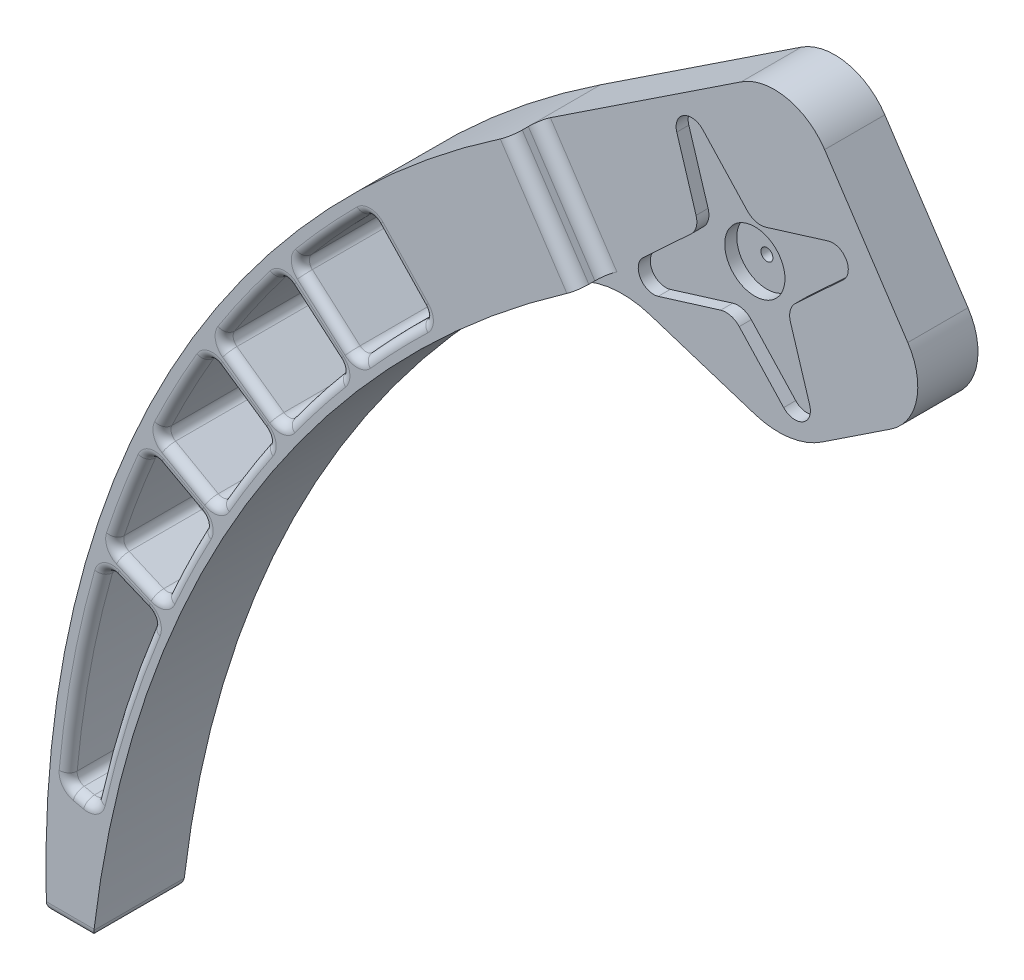
from build123d import *

# Parameters (mm, degrees)
BOSS_EXTRU_1_DEPTH           = 15
ENL_V_MAT_EXTRU_3_REACH      = 172.818
BOSS_EXTRU_4_DEPTH           = 10
BOSS_EXTRU_5_DEPTH           = 15
CONG_8_R                     = 10
CONG_18_R                    = 2
ENL_V_MAT_EXTRU_9_DEPTH      = 2
R_P_TITION_CIRCULAIRE1_COUNT = 4
R_P_TITION_CIRCULAIRE1_ANGLE = 270
ESQUISSE25_R                 = 1
ENL_V_MAT_EXTRU_10_DEPTH     = 219.334895814
ENL_V_MAT_EXTRU_11_DEPTH     = 219.417322414
CONG_21_R                    = 3
CONG_22_R                    = 15
CONG_26_R                    = 13
CONG_27_R                    = 1.5
CONG_29_R                    = 2
ESQUISSE29_R                 = 5
ENL_V_MAT_EXTRU_12_DEPTH     = 2


with BuildPart() as part:
    # Esquisse1 → Boss.-Extru.1 (new body)
    with BuildSketch(Plane.XY):
        with BuildLine():
            Line((0, 0), (-7.711590066, 0))
            ThreePointArc((-7.711590066, 0), (11.182156161, 85.064543603), (69.288409934, 150))
            Line((69.288409934, 150), (80.334895494, 133.327413015))
            ThreePointArc((80.334895494, 133.327413015), (25.572879878, 75.457495106), (0, 0))
        make_face()
    extrude(amount=BOSS_EXTRU_1_DEPTH)

    # Esquisse2 → Enlèv. mat.-Extru.3 (cut, up to next)
    with BuildSketch(Plane.XY.offset(15), mode=Mode.PRIVATE) as enl_v_mat_extru_3_sk1:
        with BuildLine():
            Line((70.96641706, 130.203543838), (62.368402817, 141.397923539))
            ThreePointArc((62.368402817, 141.397923539), (55.3312191, 135.755729793), (48.603332475, 129.748080795))
            Line((48.603332475, 129.748080795), (58.098340887, 119.395755861))
            ThreePointArc((58.098340887, 119.395755861), (64.414465587, 124.94004106), (70.96641706, 130.203543838))
        make_face()
    enl_v_mat_extru_3_tool1 = extrude(enl_v_mat_extru_3_sk1.sketch, amount=-ENL_V_MAT_EXTRU_3_REACH, mode=Mode.PRIVATE) & part.part
    # Esquisse2 → Enlèv. mat.-Extru.3 (cut, up to next)
    with BuildSketch(Plane.XY.offset(15), mode=Mode.PRIVATE) as enl_v_mat_extru_3_sk2:
        with BuildLine():
            Line((55.64063129, 117.101769262), (46.003921125, 127.247300312))
            ThreePointArc((46.003921125, 127.247300312), (39.748189667, 120.76496241), (33.84478618, 113.960206131))
            Line((33.84478618, 113.960206131), (43.972769253, 105.00810725))
            ThreePointArc((43.972769253, 105.00810725), (49.674757949, 111.182235084), (55.64063129, 117.101769262))
        make_face()
    enl_v_mat_extru_3_tool2 = extrude(enl_v_mat_extru_3_sk2.sketch, amount=-ENL_V_MAT_EXTRU_3_REACH, mode=Mode.PRIVATE) & part.part
    # Esquisse2 → Enlèv. mat.-Extru.3 (cut, up to next)
    with BuildSketch(Plane.XY.offset(15), mode=Mode.PRIVATE) as enl_v_mat_extru_3_sk3:
        with BuildLine():
            Line((41.76831014, 102.469786743), (31.588648335, 111.155864618))
            ThreePointArc((31.588648335, 111.155864618), (26.222019458, 103.954984054), (21.243322204, 96.480630566))
            Line((21.243322204, 96.480630566), (31.428497777, 89.222751389))
            ThreePointArc((31.428497777, 89.222751389), (36.453878289, 95.95907682), (41.76831014, 102.469786743))
        make_face()
    enl_v_mat_extru_3_tool3 = extrude(enl_v_mat_extru_3_sk3.sketch, amount=-ENL_V_MAT_EXTRU_3_REACH, mode=Mode.PRIVATE) & part.part
    # Esquisse2 → Enlèv. mat.-Extru.3 (cut, up to next)
    with BuildSketch(Plane.XY.offset(15), mode=Mode.PRIVATE) as enl_v_mat_extru_3_sk4:
        with BuildLine():
            Line((29.501441664, 86.467907344), (19.367668684, 93.425727966))
            ThreePointArc((19.367668684, 93.425727966), (14.975624812, 85.643194428), (10.998789498, 77.640528715))
            Line((10.998789498, 77.640528715), (20.602964124, 72.212635938))
            ThreePointArc((20.602964124, 72.212635938), (24.89667733, 79.437354376), (29.501441664, 86.467907344))
        make_face()
    enl_v_mat_extru_3_tool4 = extrude(enl_v_mat_extru_3_sk4.sketch, amount=-ENL_V_MAT_EXTRU_3_REACH, mode=Mode.PRIVATE) & part.part
    # Esquisse2 → Enlèv. mat.-Extru.3 (cut, up to next)
    with BuildSketch(Plane.XY.offset(15), mode=Mode.PRIVATE) as enl_v_mat_extru_3_sk5:
        with BuildLine():
            ThreePointArc((9.531300239, 74.392970828), (6.174876057, 66.176369668), (3.252056799, 57.795722587))
            Line((3.252056799, 57.795722587), (11.614775105, 54.164127283))
            ThreePointArc((11.614775105, 54.164127283), (15.129778185, 61.798083201), (18.97442424, 69.271451003))
            Line((18.97442424, 69.271451003), (9.531300239, 74.392970828))
        make_face()
    enl_v_mat_extru_3_tool5 = extrude(enl_v_mat_extru_3_sk5.sketch, amount=-ENL_V_MAT_EXTRU_3_REACH, mode=Mode.PRIVATE) & part.part
    # Esquisse2 → Enlèv. mat.-Extru.3 (cut, up to next)
    with BuildSketch(Plane.XY.offset(15), mode=Mode.PRIVATE) as enl_v_mat_extru_3_sk6:
        with BuildLine():
            ThreePointArc((2.210245397, 54.416383156), (-1.903846469, 37.388887214), (-4.243080029, 20.028318206))
            Line((-4.243080029, 20.028318206), (0.22058881, 19.040921771))
            ThreePointArc((0.22058881, 19.040921771), (4.5624072, 35.274968661), (10.302594075, 51.068825695))
            Line((10.302594075, 51.068825695), (2.210245397, 54.416383156))
        make_face()
    enl_v_mat_extru_3_tool6 = extrude(enl_v_mat_extru_3_sk6.sketch, amount=-ENL_V_MAT_EXTRU_3_REACH, mode=Mode.PRIVATE) & part.part
    add(enl_v_mat_extru_3_tool1.solids().sort_by_distance((59.870213, 130.362221, 15))[0], mode=Mode.SUBTRACT)
    add(enl_v_mat_extru_3_tool2.solids().sort_by_distance((44.740256, 116.01744, 15))[0], mode=Mode.SUBTRACT)
    add(enl_v_mat_extru_3_tool3.solids().sort_by_distance((31.397446, 100.037946, 15))[0], mode=Mode.SUBTRACT)
    add(enl_v_mat_extru_3_tool4.solids().sort_by_distance((20.026102, 82.672126, 15))[0], mode=Mode.SUBTRACT)
    add(enl_v_mat_extru_3_tool5.solids().sort_by_distance((10.771598, 64.195475, 15))[0], mode=Mode.SUBTRACT)
    add(enl_v_mat_extru_3_tool6.solids().sort_by_distance((2.002561, 37.996615, 15))[0], mode=Mode.SUBTRACT)

    # Esquisse12 → Boss.-Extru.4 (add)
    with BuildSketch(Plane.XY):
        Polygon((94.143002443, 112.486679283), (69.288409934, 150), (110.969877398, 177.616213898), (135.824469907, 140.102893181), align=None)
    extrude(amount=BOSS_EXTRU_4_DEPTH)

    # Esquisse27 → Boss.-Extru.5 (add)
    with BuildSketch(Plane.XY.offset(15)):
        Polygon((47.188124313, 129.684136283), (58.056535221, 117.812045061), (72.720408854, 130.189666898), (62.35617322, 143.569860805), align=None)
    extrude(amount=-BOSS_EXTRU_5_DEPTH)

    # Congé8
    cong_8_edges = [part.edges().sort_by_distance(p)[0] for p in [
        (135.824469907, 140.102893181, 5),
        (110.969877398, 177.616213898, 5),
    ]]
    fillet(cong_8_edges, radius=CONG_8_R)

    # Congé18
    cong_18_edges = [part.edges().sort_by_distance(p)[0] for p in [
        (74.811652714, 141.663706507, 10),
    ]]
    fillet(cong_18_edges, radius=CONG_18_R)

    # Esquisse24 → Enlèv. mat.-Extru.9 (cut)
    with BuildSketch(Plane(origin=(82.663768185, -34.602394107, 10), x_dir=(0.8660254037844382, 0.500000000000001, 0), z_dir=(0, 0, 1))):
        with BuildLine():
            Line((89.846225747, 148.226938795), (107.396154522, 152.226938795))
            ThreePointArc((107.396154522, 152.226938795), (114.097489553, 145.726938795), (107.396154522, 139.226938795))
            Line((107.396154522, 139.226938795), (89.846225747, 143.226938795))
            ThreePointArc((89.846225747, 143.226938795), (87.851915659, 145.726938795), (89.846225747, 148.226938795))
        make_face()
    enl_v_mat_extru_9 = extrude(amount=-ENL_V_MAT_EXTRU_9_DEPTH, mode=Mode.SUBTRACT)

    # Répétition circulaire1: Enlèv. mat.-Extru.9 ×4 about axis
    r_p_tition_circulaire1_axis = Axis((102.979838867, 145.398069453, 0), (0, 0, 1))
    for i in range(1, R_P_TITION_CIRCULAIRE1_COUNT):
        add(enl_v_mat_extru_9.rotate(r_p_tition_circulaire1_axis, i * R_P_TITION_CIRCULAIRE1_ANGLE / (R_P_TITION_CIRCULAIRE1_COUNT - 1)), mode=Mode.SUBTRACT)

    # Esquisse25 → Enlèv. mat.-Extru.10 (cut, through all)
    with BuildSketch(Plane.XY.offset(8)):
        with Locations((102.90591709, 145.401940544)):
            Circle(ESQUISSE25_R)
    extrude(amount=-ENL_V_MAT_EXTRU_10_DEPTH, mode=Mode.SUBTRACT)

    # Esquisse26 → Enlèv. mat.-Extru.11 (cut, through all)
    with BuildSketch(Plane.XY.offset(10)):
        Polygon((80.334895494, 133.327413015), (94.143002443, 112.486679283), (110.815589428, 123.533164842), align=None)
    extrude(amount=-ENL_V_MAT_EXTRU_11_DEPTH, mode=Mode.SUBTRACT)

    # Congé21
    cong_21_edges = [part.edges().sort_by_distance(p)[0] for p in [
        (101.028810363, 138.116731947, 9),
        (95.698501361, 147.349097958, 9),
        (110.261176374, 143.447040948, 9),
        (104.930867372, 152.679406959, 9),
    ]]
    fillet(cong_21_edges, radius=CONG_21_R)

    # Congé22
    cong_22_edges = [part.edges().sort_by_distance(p)[0] for p in [
        (80.334895494, 133.327413015, 5),
    ]]
    fillet(cong_22_edges, radius=CONG_22_R)

    # Congé26
    cong_26_edges = [part.edges().sort_by_distance(p)[0] for p in [
        (110.815589428, 123.533164842, 5),
    ]]
    fillet(cong_26_edges, radius=CONG_26_R)

    # Congé27
    cong_27_edges = [part.edges().sort_by_distance(p)[0] for p in [
        (-3.855795033, 0, 15),
        (24.434555174, 89.946817655, 0),
        (19.367668684, 93.425727966, 7.5),
        (24.434555174, 89.946817655, 15),
        (24.89667733, 79.437354376, 0),
        (29.501441664, 86.467907344, 7.5),
        (24.89667733, 79.437354376, 15),
        (20.602964124, 72.212635938, 7.5),
        (10.998789498, 77.640528715, 7.5),
        (14.975624812, 85.643194428, 15),
        (15.800876811, 74.926582326, 15),
        (15.800876811, 74.926582326, 0),
        (14.975624812, 85.643194428, 0),
        (14.25286224, 71.832210916, 0),
        (9.531300239, 74.392970828, 7.5),
        (14.25286224, 71.832210916, 15),
        (15.129778185, 61.798083201, 0),
        (18.97442424, 69.271451003, 7.5),
        (15.129778185, 61.798083201, 15),
        (11.614775105, 54.164127283, 7.5),
        (3.252056799, 57.795722587, 7.5),
        (6.174876057, 66.176369668, 15),
        (7.433415952, 55.979924935, 15),
        (7.433415952, 55.979924935, 0),
        (6.174876057, 66.176369668, 0),
        (50.822276207, 122.174534787, 0),
        (46.003921125, 127.247300312, 7.5),
        (50.822276207, 122.174534787, 15),
        (49.674757949, 111.182235084, 0),
        (55.64063129, 117.101769262, 7.5),
        (49.674757949, 111.182235084, 15),
        (43.972769253, 105.00810725, 7.5),
        (33.84478618, 113.960206131, 7.5),
        (39.748189667, 120.76496241, 15),
        (-3.855795033, 0, 0),
        (38.908777716, 109.484156691, 15),
        (38.908777716, 109.484156691, 0),
        (39.748189667, 120.76496241, 0),
        (36.678479238, 106.81282568, 0),
        (31.588648335, 111.155864618, 7.5),
        (36.678479238, 106.81282568, 15),
        (36.453878289, 95.95907682, 0),
        (41.76831014, 102.469786743, 7.5),
        (36.453878289, 95.95907682, 15),
        (31.428497777, 89.222751389, 7.5),
        (21.243322204, 96.480630566, 7.5),
        (26.222019458, 103.954984054, 15),
        (26.335909991, 92.851690978, 15),
        (26.335909991, 92.851690978, 0),
        (26.222019458, 103.954984054, 0),
        (6.256419736, 52.742604425, 0),
        (2.210245397, 54.416383156, 7.5),
        (6.256419736, 52.742604425, 15),
        (4.5624072, 35.274968661, 0),
        (10.302594075, 51.068825695, 7.5),
        (4.5624072, 35.274968661, 15),
        (0.22058881, 19.040921771, 7.5),
        (-4.243080029, 20.028318206, 7.5),
        (-1.903846469, 37.388887214, 15),
        (-2.01124561, 19.534619988, 15),
        (-2.01124561, 19.534619988, 0),
        (-1.903846469, 37.388887214, 0),
        (0, 0, 7.5),
        (-7.711590066, 0, 7.5),
    ]]
    fillet(cong_27_edges, radius=CONG_27_R)

    # Congé29
    cong_29_edges = [part.edges().sort_by_distance(p)[0] for p in [
        (74.811652714, 141.663706507, 15),
    ]]
    fillet(cong_29_edges, radius=CONG_29_R)

    # Esquisse29 → Enlèv. mat.-Extru.12 (cut)
    with BuildSketch(Plane.XY.offset(8)):
        with Locations((102.90591709, 145.401940544)):
            Circle(ESQUISSE29_R)
    extrude(amount=-ENL_V_MAT_EXTRU_12_DEPTH, mode=Mode.SUBTRACT)


solid = part.part
